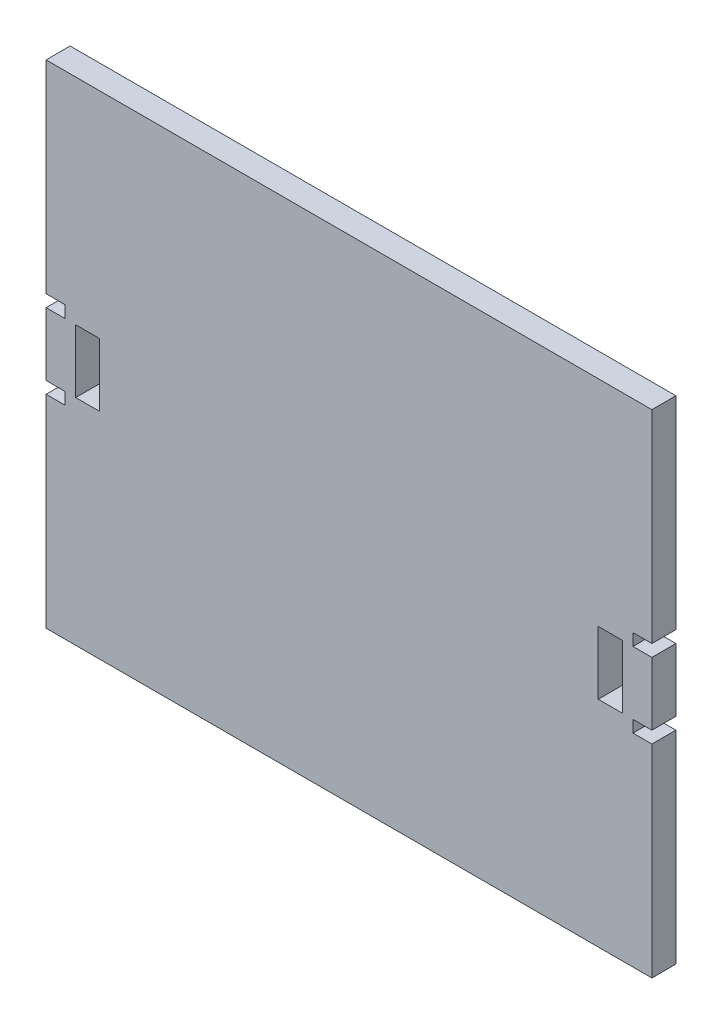
from build123d import *

# Parameters (mm, degrees)
SKETCH1_W           = 6.35
SKETCH1_H           = 16.66
BOSS_EXTRUDE1_DEPTH = 6.35


with BuildPart() as part:
    # Sketch1 → Boss-Extrude1 (new body)
    with BuildSketch(Plane.XY):
        Polygon((-80, 0), (80, 0), (80, 53.52), (75, 53.52), (75, 56.67), (80, 56.67), (80, 73.33), (75, 73.33), (75, 76.505), (80, 76.505), (80, 130), (-80, 130), (-80, 76.505), (-75, 76.505), (-75, 73.33), (-80, 73.33), (-80, 56.67), (-75, 56.67), (-75, 53.52), (-80, 53.52), align=None)
        with Locations((69, 65)):
            Rectangle(SKETCH1_W, SKETCH1_H, mode=Mode.SUBTRACT)
        with Locations((-69, 65)):
            Rectangle(SKETCH1_W, SKETCH1_H, mode=Mode.SUBTRACT)
    extrude(amount=BOSS_EXTRUDE1_DEPTH)


solid = part.part
